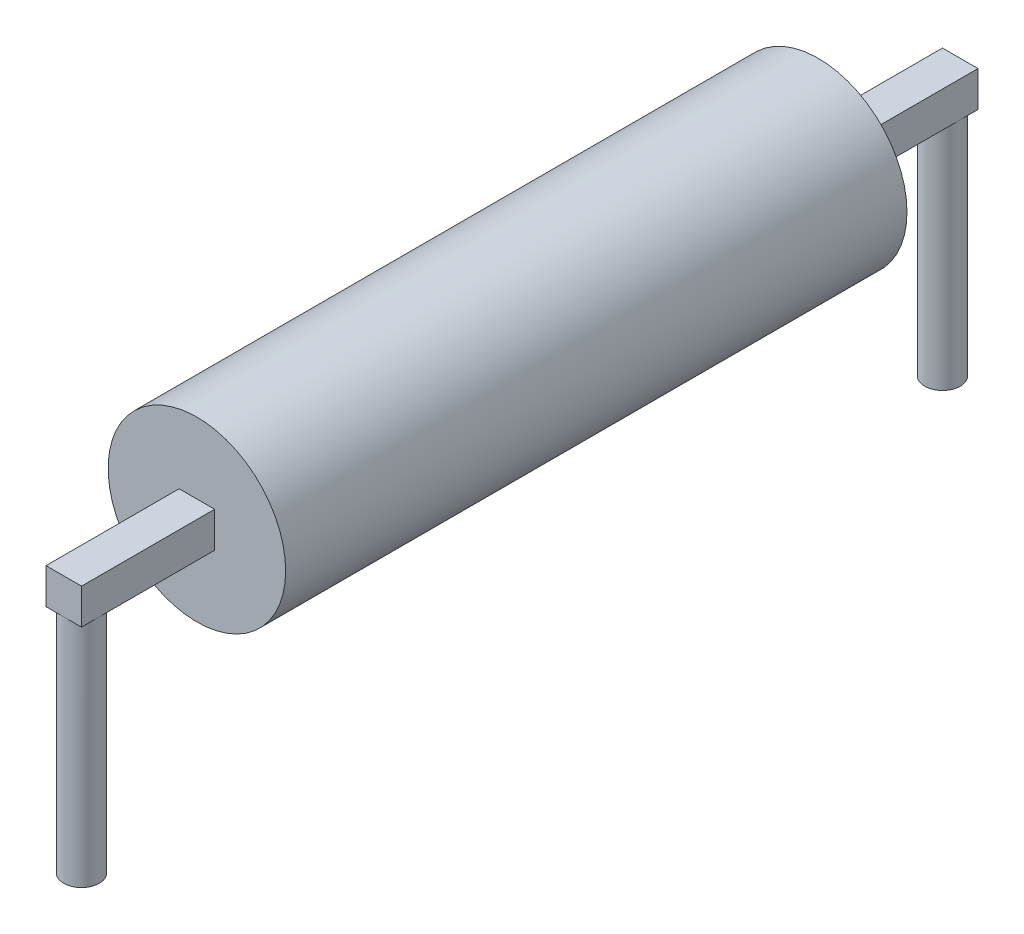
from build123d import *

# Parameters (mm, degrees)
SKETCH_1_R           = 2.5
EXTRUDE_1_DEPTH      = 17.5
EXTRUDE_2_DEPTH      = 3.75
EXTRUDE_2_DEPTH_BACK = 21.5
SKETCH_2_W           = 1
SKETCH_2_H           = 1
SKETCH_3_R           = 0.5
EXTRUDE_3_DEPTH      = 6.5


with BuildPart() as part:
    # Эскиз1 → Вытянуть1 (new body)
    with BuildSketch(Plane.XY):
        Circle(SKETCH_1_R)
    extrude(amount=EXTRUDE_1_DEPTH)

    # Эскиз2 → Вытянуть2 (add, two sides: drawn at the far end of the back side and taken through both)
    with BuildSketch(Plane.XY.offset(17.5).offset(-EXTRUDE_2_DEPTH_BACK)):
        Rectangle(SKETCH_2_W, SKETCH_2_H)
    extrude(amount=EXTRUDE_2_DEPTH + EXTRUDE_2_DEPTH_BACK)

    # Эскиз3 → Вытянуть3 (add)
    with BuildSketch(Plane.XZ.offset(0.5)):
        with Locations((0, 20.75)):
            Circle(SKETCH_3_R)
        with Locations((0, -3.5)):
            Circle(SKETCH_3_R)
    extrude(amount=EXTRUDE_3_DEPTH)


solid = part.part
